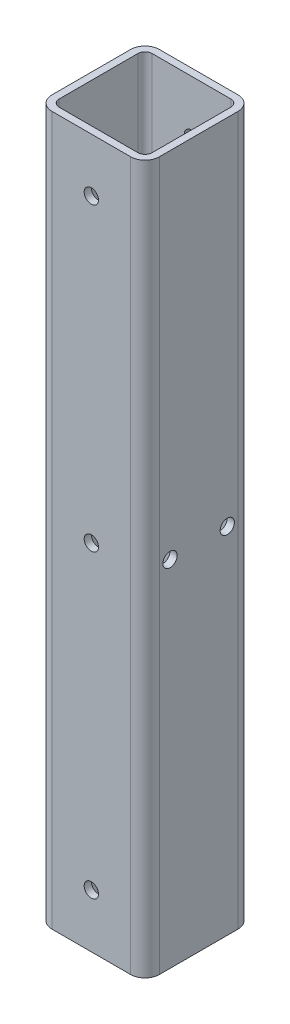
from build123d import *

# Parameters (mm, degrees)
EXTRUDE_1_DEPTH          = 99
CUT_EXTRUDE_1_DEPTH      = 102.247222184
CUT_EXTRUDE_1_DEPTH_BACK = 102.247222184
SKETCH_2_R               = 2
CUT_EXTRUDE_2_DEPTH      = 102.247222184
CUT_EXTRUDE_2_DEPTH_BACK = 102.247222184
SKETCH_3_R               = 2


with BuildPart() as part:
    # 草图1 → 凸台-拉伸1 (new, symmetric)
    with BuildSketch(Plane(origin=(0, 0, 0), x_dir=(1, 0, 0), z_dir=(0, 1, 0))):
        with BuildLine():
            Line((-11, -15), (11, -15))
            ThreePointArc((11, -15), (13.828427125, -13.828427125), (15, -11))
            Line((15, -11), (15, 11))
            ThreePointArc((15, 11), (13.828427125, 13.828427125), (11, 15))
            Line((11, 15), (-11, 15))
            ThreePointArc((-11, 15), (-13.828427125, 13.828427125), (-15, 11))
            Line((-15, 11), (-15, -11))
            ThreePointArc((-15, -11), (-13.828427125, -13.828427125), (-11, -15))
        make_face()
        with BuildLine():
            Line((-11, -13), (11, -13))
            ThreePointArc((11, -13), (12.414213562, -12.414213562), (13, -11))
            Line((13, -11), (13, 11))
            ThreePointArc((13, 11), (12.414213562, 12.414213562), (11, 13))
            Line((11, 13), (-11, 13))
            ThreePointArc((-11, 13), (-12.414213562, 12.414213562), (-13, 11))
            Line((-13, 11), (-13, -11))
            ThreePointArc((-13, -11), (-12.414213562, -12.414213562), (-11, -13))
        make_face(mode=Mode.SUBTRACT)
    extrude(amount=EXTRUDE_1_DEPTH, both=True)

    # 草图2 → 切除-拉伸1 (cut, two sides: drawn at the far end of the back side and taken through both)
    with BuildSketch(Plane(origin=(0, 0, 0), x_dir=(0, 0, -1), z_dir=(1, 0, 0)).offset(-CUT_EXTRUDE_1_DEPTH_BACK)):
        with Locations((8, 0)):
            Circle(SKETCH_2_R)
        with Locations((-8, 0)):
            Circle(SKETCH_2_R)
    extrude(amount=CUT_EXTRUDE_1_DEPTH + CUT_EXTRUDE_1_DEPTH_BACK, mode=Mode.SUBTRACT)

    # 草图3 → 切除-拉伸2 (cut, two sides: drawn at the far end of the back side and taken through both)
    with BuildSketch(Plane.XY.offset(-CUT_EXTRUDE_2_DEPTH_BACK)):
        with Locations((0, 84)):
            Circle(SKETCH_3_R)
        Circle(SKETCH_3_R)
        with Locations((0, -84)):
            Circle(SKETCH_3_R)
    extrude(amount=CUT_EXTRUDE_2_DEPTH + CUT_EXTRUDE_2_DEPTH_BACK, mode=Mode.SUBTRACT)


solid = part.part
